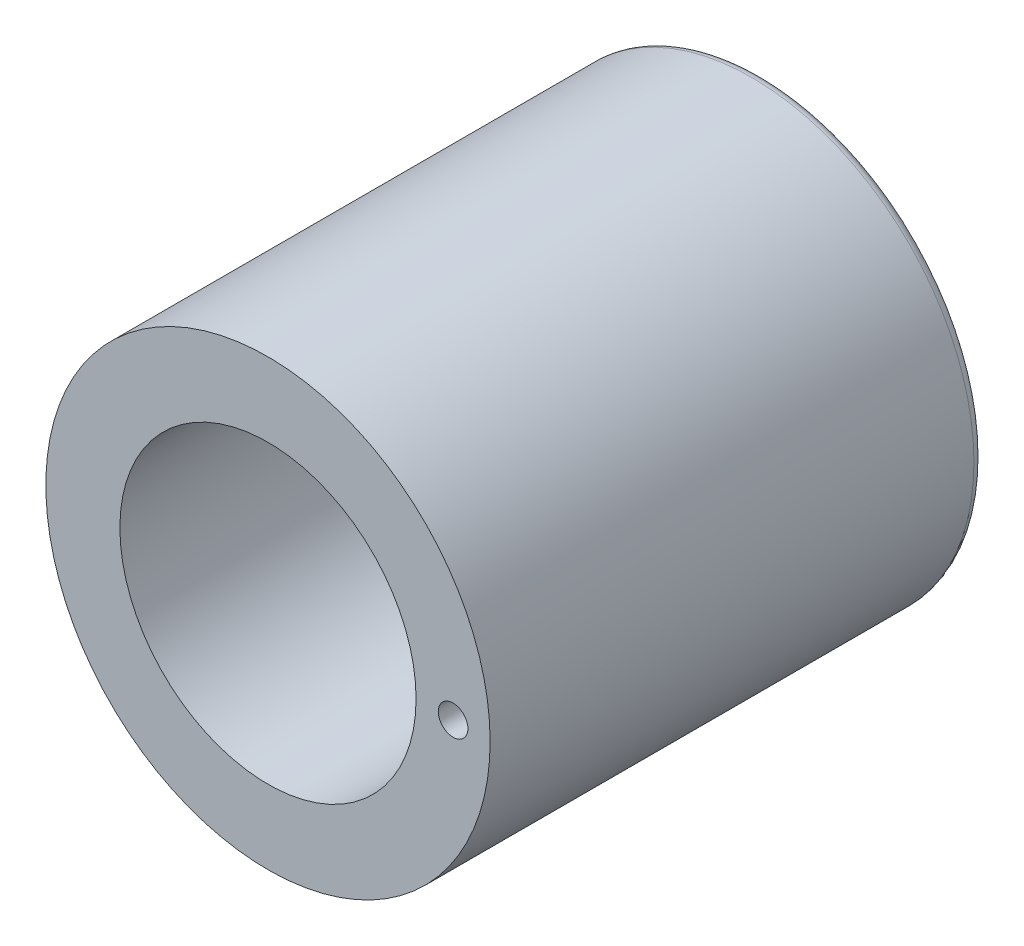
from build123d import *

# Parameters (mm, degrees)
ESQUISSE1_R             = 45
BASE_EXTRUSION_DEPTH    = 100
ESQUISSE2_R             = 30
ENL_V_MAT_EXTRU_1_DEPTH = 100
ESQUISSE3_R             = 3
ENL_V_MAT_EXTRU_2_DEPTH = 30
CONG_1_R                = 2


with BuildPart() as part:
    # Esquisse1 → Base-Extrusion (new body)
    with BuildSketch(Plane.XY):
        Circle(ESQUISSE1_R)
    extrude(amount=BASE_EXTRUSION_DEPTH)

    # Esquisse2 → Enlèv. mat.-Extru.1 (cut)
    with BuildSketch(Plane.XY.offset(100)):
        Circle(ESQUISSE2_R)
    extrude(amount=-ENL_V_MAT_EXTRU_1_DEPTH, mode=Mode.SUBTRACT)

    # Esquisse3 → Enlèv. mat.-Extru.2 (cut)
    with BuildSketch(Plane.XY.offset(100)):
        with Locations((37.5, 0)):
            Circle(ESQUISSE3_R)
    extrude(amount=-ENL_V_MAT_EXTRU_2_DEPTH, mode=Mode.SUBTRACT)

    # Congé1
    cong_1_edges = [part.edges().sort_by_distance(p)[0] for p in [
        (-45, 0, 0),
    ]]
    fillet(cong_1_edges, radius=CONG_1_R)


solid = part.part
